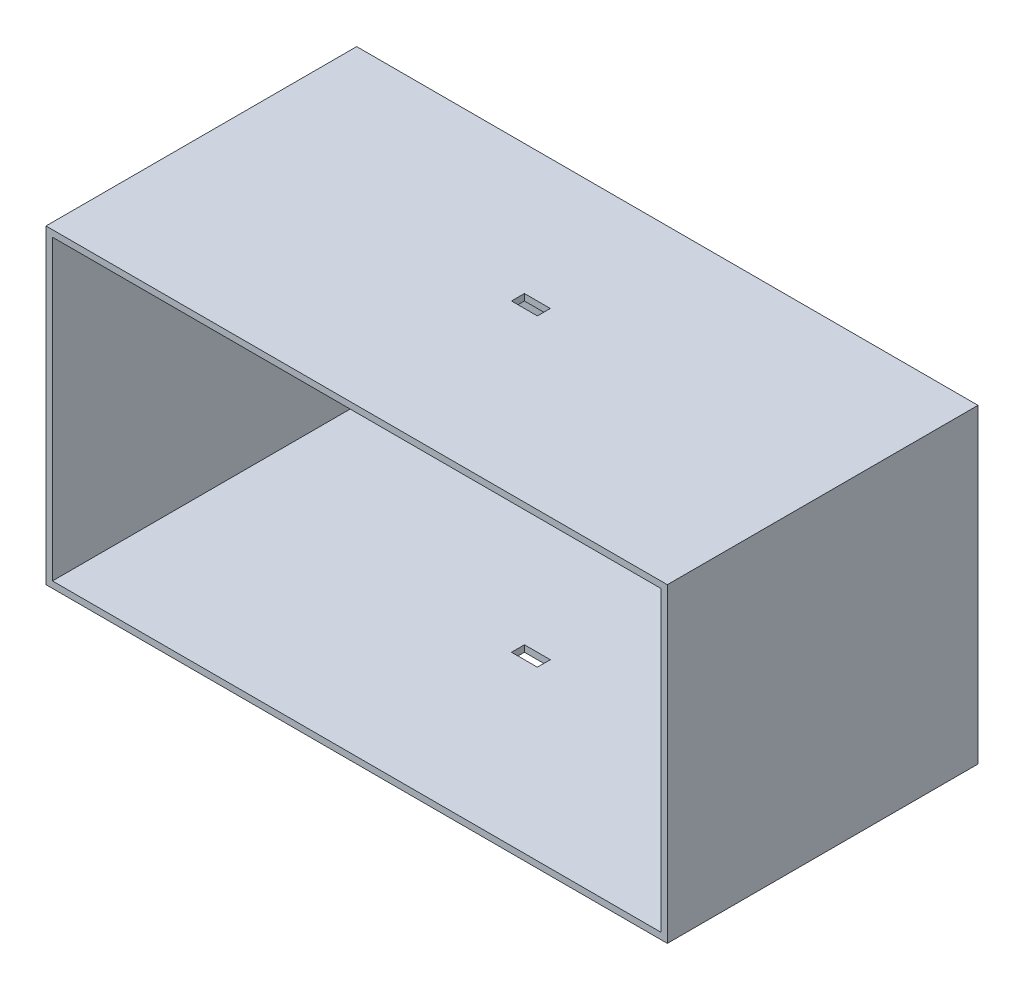
from build123d import *

# Parameters (mm, degrees)
SKETCH2_W           = 304.8
SKETCH2_H           = 152.4
BOSS_EXTRUDE1_DEPTH = 152.4
SHELL1_T            = -3.175
SKETCH3_W           = 12.7
SKETCH3_H           = 6.35
CUT_EXTRUDE1_DEPTH  = 374.3022368


with BuildPart() as part:
    # Sketch2 → Boss-Extrude1 (new body)
    with BuildSketch(Plane.XY):
        with Locations((152.4, 76.2)):
            Rectangle(SKETCH2_W, SKETCH2_H)
    extrude(amount=BOSS_EXTRUDE1_DEPTH)

    # Shell1
    shell1_openings = [part.faces().sort_by_distance(p)[0] for p in [
        (152.4, 76.2, 152.4),
    ]]
    offset(amount=SHELL1_T, openings=shell1_openings, kind=Kind.INTERSECTION)

    # Sketch3 → Cut-Extrude1 (cut, through all)
    with BuildSketch(Plane.XZ):
        with Locations((152.4, 66.929)):
            Rectangle(SKETCH3_W, SKETCH3_H)
    extrude(amount=-CUT_EXTRUDE1_DEPTH, mode=Mode.SUBTRACT)


solid = part.part
